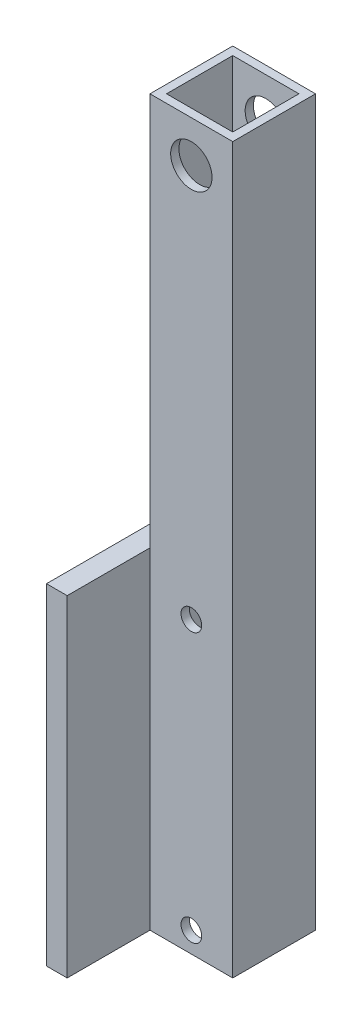
from build123d import *

# Parameters (mm, degrees)
SKETCH1_W           = 25.4
SKETCH1_H           = 25.4
SKETCH1_W_2         = 20.32
SKETCH1_H_2         = 20.32
BOSS_EXTRUDE1_DEPTH = 222.25
SKETCH2_R           = 6.35
SKETCH2_R_2         = 3.175
CUT_EXTRUDE1_DEPTH  = 222.25
SKETCH4_W           = 76.2
SKETCH4_H           = 101.6
BOSS_EXTRUDE3_DEPTH = 6.35


with BuildPart() as part:
    # Sketch1 → Boss-Extrude1 (new body)
    with BuildSketch(Plane(origin=(0, 0, 0), x_dir=(1, 0, 0), z_dir=(0, 1, 0))):
        Rectangle(SKETCH1_W, SKETCH1_H)
        Rectangle(SKETCH1_W_2, SKETCH1_H_2, mode=Mode.SUBTRACT)
    extrude(amount=BOSS_EXTRUDE1_DEPTH)

    # Sketch2 → Cut-Extrude1 (cut)
    with BuildSketch(Plane.XY.offset(12.7)):
        with Locations((0, 209.55)):
            Circle(SKETCH2_R)
        with Locations((0, 6.35)):
            Circle(SKETCH2_R_2)
        with Locations((0, 88.9)):
            Circle(SKETCH2_R_2)
    extrude(amount=-CUT_EXTRUDE1_DEPTH, mode=Mode.SUBTRACT)

    # Sketch4 → Boss-Extrude3 (add)
    with BuildSketch(Plane.ZY.offset(12.7)):
        with Locations((0, 50.8)):
            Rectangle(SKETCH4_W, SKETCH4_H)
    extrude(amount=BOSS_EXTRUDE3_DEPTH)


solid = part.part
